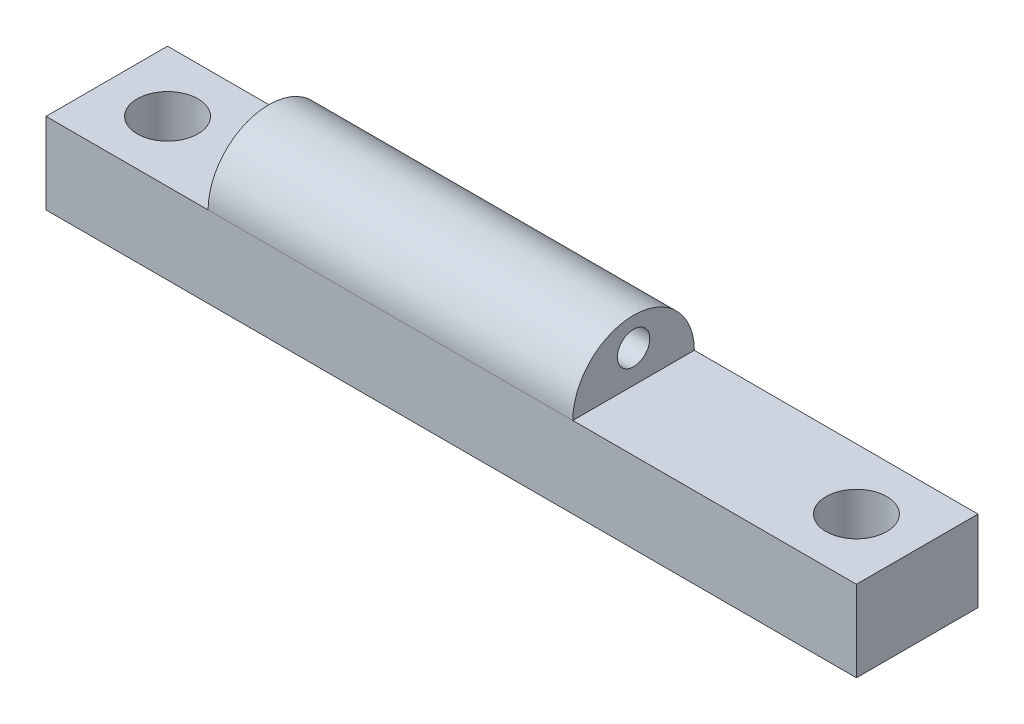
from build123d import *

# Parameters (mm, degrees)
SKETCH1_W           = 50.8
SKETCH1_H           = 7.62
BOSS_EXTRUDE1_DEPTH = 5.08
BOSS_EXTRUDE2_START = -17.78
SKETCH2_R           = 1.016
BOSS_EXTRUDE2_DEPTH = 22.86
SKETCH3_R           = 1.905
CUT_EXTRUDE1_DEPTH  = 27.181720723


with BuildPart() as part:
    # Sketch1 → Boss-Extrude1 (new body)
    with BuildSketch(Plane(origin=(0, 0, 0), x_dir=(1, 0, 0), z_dir=(0, 1, 0))):
        Rectangle(SKETCH1_W, SKETCH1_H)
    extrude(amount=BOSS_EXTRUDE1_DEPTH)

    # Sketch3 → Cut-Extrude1 (cut, through all)
    with BuildSketch(Plane(origin=(0, 5.08, 0), x_dir=(1, 0, 0), z_dir=(0, 1, 0))):
        with Locations(Location((-21.59, 0, 0), (0, 0, 270))):
            Circle(SKETCH3_R)
        with Locations(Location((21.59, 0, 0), (0, 0, 270))):
            Circle(SKETCH3_R)
    extrude(amount=-CUT_EXTRUDE1_DEPTH, mode=Mode.SUBTRACT)


with BuildPart() as body_2:
    # Sketch2 → Boss-Extrude2 (new body)
    with BuildSketch(Plane(origin=(25.4, 0, 0), x_dir=(0, 0, -1), z_dir=(1, 0, 0)).offset(BOSS_EXTRUDE2_START)):
        with BuildLine():
            Line((3.81, 5.08), (-3.81, 5.08))
            ThreePointArc((-3.81, 5.08), (0, 8.89), (3.81, 5.08))
        make_face()
        with Locations((0, 7.112)):
            Circle(SKETCH2_R, mode=Mode.SUBTRACT)
    extrude(amount=-BOSS_EXTRUDE2_DEPTH)


solid = Compound([part.part, body_2.part])
